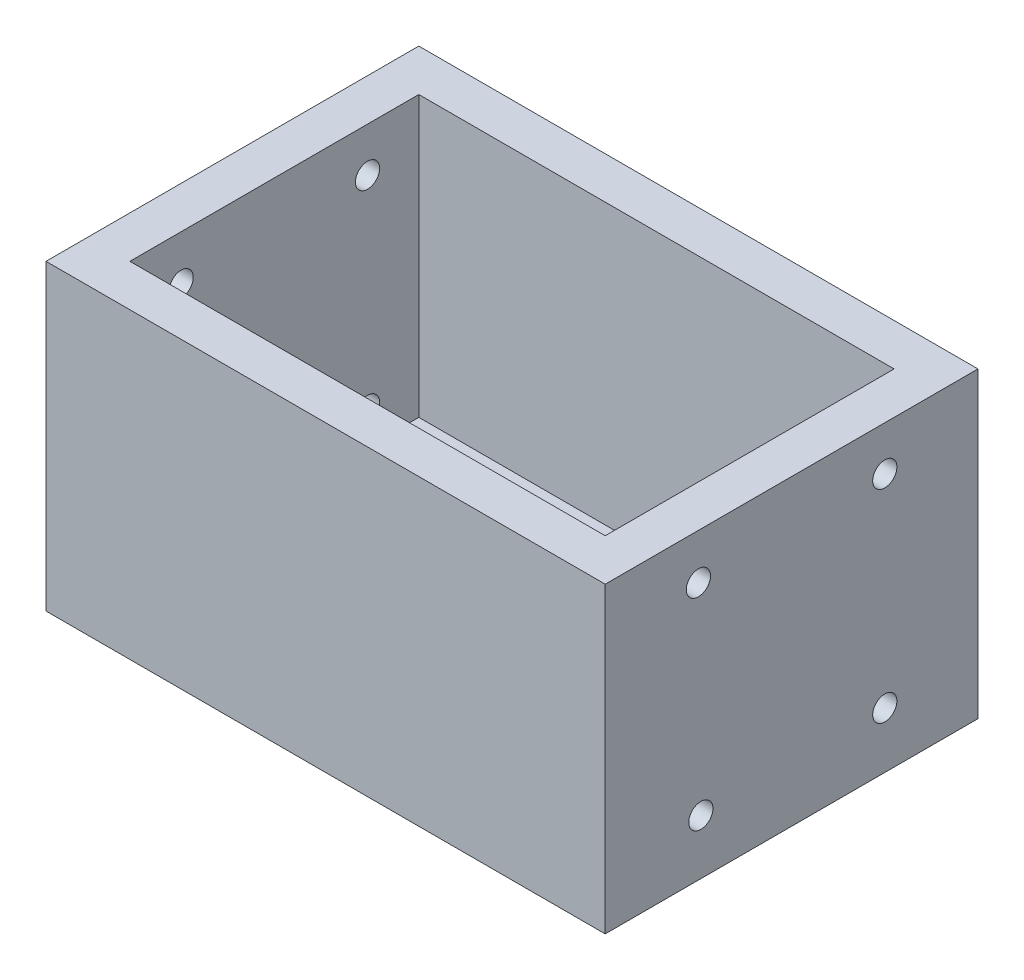
from build123d import *

# Parameters (mm, degrees)
SKETCH1_W           = 120
SKETCH1_H           = 80
SKETCH1_W_2         = 102
SKETCH1_H_2         = 62
BOSS_EXTRUDE1_DEPTH = 60
SKETCH2_W           = 120
SKETCH2_H           = 80
BOSS_EXTRUDE2_DEPTH = 5
SKETCH5_R           = 2.6
CUT_EXTRUDE1_DEPTH  = 141
SKETCH6_R           = 5
CUT_EXTRUDE2_DEPTH  = 94.808315196
SKETCH7_W           = 26.53085
SKETCH7_H           = 10
BOSS_EXTRUDE3_DEPTH = 15
SKETCH8_W           = 4
SKETCH8_H           = 6.5
SKETCH8_R           = 1.5
CUT_EXTRUDE3_DEPTH  = 10


with BuildPart() as part:
    # Sketch1 → Boss-Extrude1 (new body)
    with BuildSketch(Plane(origin=(0, 0, 0), x_dir=(1, 0, 0), z_dir=(0, 1, 0))):
        Rectangle(SKETCH1_W, SKETCH1_H)
        Rectangle(SKETCH1_W_2, SKETCH1_H_2, mode=Mode.SUBTRACT)
    extrude(amount=BOSS_EXTRUDE1_DEPTH)

    # Sketch2 → Boss-Extrude2 (add)
    with BuildSketch(Plane.XZ):
        Rectangle(SKETCH2_W, SKETCH2_H)
    extrude(amount=BOSS_EXTRUDE2_DEPTH)

    # Sketch5 → Cut-Extrude1 (cut, through all)
    with BuildSketch(Plane.ZY.offset(60)):
        with Locations((-20, 50.5)):
            Circle(SKETCH5_R)
        with Locations((20, 50.25689587)):
            Circle(SKETCH5_R)
        with Locations((-20, 7)):
            Circle(SKETCH5_R)
        with Locations((19.471268046, 6.760109293)):
            Circle(SKETCH5_R)
    extrude(amount=-CUT_EXTRUDE1_DEPTH, mode=Mode.SUBTRACT)

    # Sketch6 → Cut-Extrude2 (cut, through all)
    with BuildSketch(Plane(origin=(0, 0, 0), x_dir=(1, 0, 0), z_dir=(0, 1, 0))):
        with Locations(Location((0, 0, 0), (0, 0, 270))):
            Circle(SKETCH6_R)
    extrude(amount=-CUT_EXTRUDE2_DEPTH, mode=Mode.SUBTRACT)

    # Sketch7 → Boss-Extrude3 (add)
    with BuildSketch(Plane.XZ.offset(5)):
        with Locations((0, -15)):
            Rectangle(SKETCH7_W, SKETCH7_H)
    extrude(amount=BOSS_EXTRUDE3_DEPTH)

    # Sketch8 → Cut-Extrude3 (cut)
    with BuildSketch(Plane.XZ.offset(20)):
        with Locations((0, -13.25)):
            Rectangle(SKETCH8_W, SKETCH8_H)
        with Locations(Location((-5.000005, -14.5, 0), (0, 0, 270))):
            Circle(SKETCH8_R)
        with Locations(Location((5.000005, -14.5, 0), (0, 0, 270))):
            Circle(SKETCH8_R)
    extrude(amount=-CUT_EXTRUDE3_DEPTH, mode=Mode.SUBTRACT)


solid = part.part
